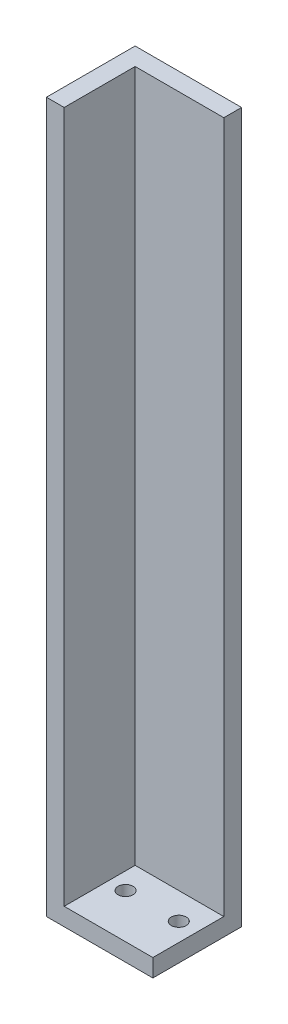
from build123d import *

# Parameters (mm, degrees)
SKETCH1_W           = 60
SKETCH1_H           = 50
BOSS_EXTRUDE1_DEPTH = 200
SKETCH2_W           = 40
SKETCH2_H           = 390
CUT_EXTRUDE1_DEPTH  = 50
SKETCH4_R           = 4.2
CUT_EXTRUDE3_DEPTH  = 402.901729282


with BuildPart() as part:
    # Sketch1 → Boss-Extrude1 (new, symmetric)
    with BuildSketch(Plane(origin=(0, 0, 0), x_dir=(1, 0, 0), z_dir=(0, 1, 0))):
        Rectangle(SKETCH1_W, SKETCH1_H)
    extrude(amount=BOSS_EXTRUDE1_DEPTH, both=True)

    # Sketch2 → Cut-Extrude1 (cut)
    with BuildSketch(Plane(origin=(30, 0, 0), x_dir=(0, 0, -1), z_dir=(1, 0, 0))):
        with Locations((-5, 5)):
            Rectangle(SKETCH2_W, SKETCH2_H)
    extrude(amount=-CUT_EXTRUDE1_DEPTH, mode=Mode.SUBTRACT)

    # Sketch4 → Cut-Extrude3 (cut, through all)
    with BuildSketch(Plane.XZ.offset(200)):
        with Locations(Location((-10.4, 0, 0), (0, 0, 270))):
            Circle(SKETCH4_R)
        with Locations(Location((19.6, 0, 0), (0, 0, 270))):
            Circle(SKETCH4_R)
    extrude(amount=-CUT_EXTRUDE3_DEPTH, mode=Mode.SUBTRACT)


solid = part.part
